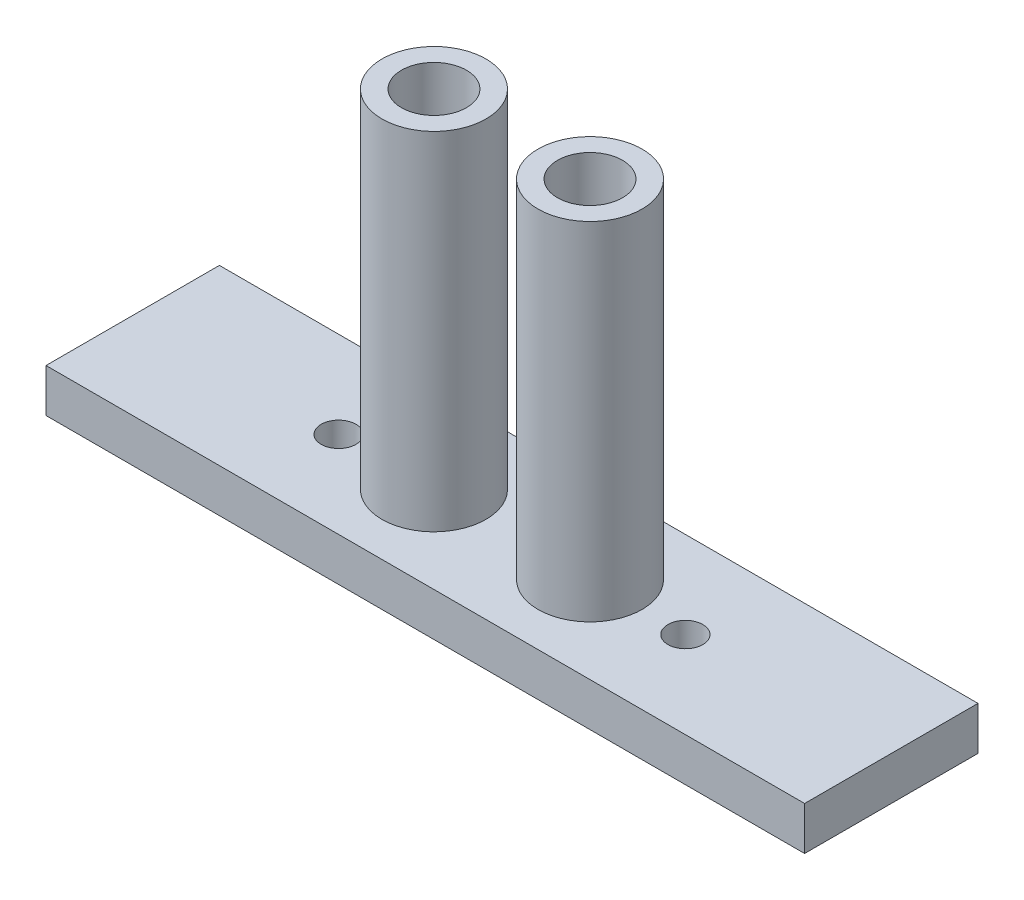
from build123d import *

# Parameters (mm, degrees)
SKETCH1_W           = 111.125
SKETCH1_H           = 25.4
BOSS_EXTRUDE1_DEPTH = 6.35
SKETCH2_R           = 7.62
SKETCH2_R_2         = 4.7625
BOSS_EXTRUDE2_DEPTH = 50.8
SKETCH2_9_R         = 2.5527
CUT_EXTRUDE1_DEPTH  = 125.798099445


with BuildPart() as part:
    # Sketch1 → Boss-Extrude1 (new body)
    with BuildSketch(Plane(origin=(0, 0, 0), x_dir=(1, 0, 0), z_dir=(0, 1, 0))):
        with Locations((-55.5625, -12.7)):
            Rectangle(SKETCH1_W, SKETCH1_H)
    extrude(amount=BOSS_EXTRUDE1_DEPTH)

    # Sketch2 → Boss-Extrude2 (add)
    # profile 1 of 2: a face of its own
    with BuildSketch(Plane(origin=(0, 6.35, 0), x_dir=(1, 0, 0), z_dir=(0, 1, 0))):
        with Locations((-44.1325, -12.7)):
            Circle(SKETCH2_R)
        with Locations((-44.1325, -12.7)):
            Circle(SKETCH2_R_2, mode=Mode.SUBTRACT)
    # profile 2 of 2: a face of its own
    with BuildSketch(Plane(origin=(0, 6.35, 0), x_dir=(1, 0, 0), z_dir=(0, 1, 0))):
        with Locations((-66.9925, -12.7)):
            Circle(SKETCH2_R)
        with Locations((-66.9925, -12.7)):
            Circle(SKETCH2_R_2, mode=Mode.SUBTRACT)
    extrude(amount=BOSS_EXTRUDE2_DEPTH)

    # Sketch2<9> → Cut-Extrude1 (cut, through all)
    with BuildSketch(Plane(origin=(0, 6.35, 0), x_dir=(1, 0, 0), z_dir=(0, 1, 0))):
        with Locations((-30.1625, -12.7)):
            Circle(SKETCH2_9_R)
        with Locations((-80.9625, -12.7)):
            Circle(SKETCH2_9_R)
    extrude(amount=-CUT_EXTRUDE1_DEPTH, mode=Mode.SUBTRACT)


solid = part.part
